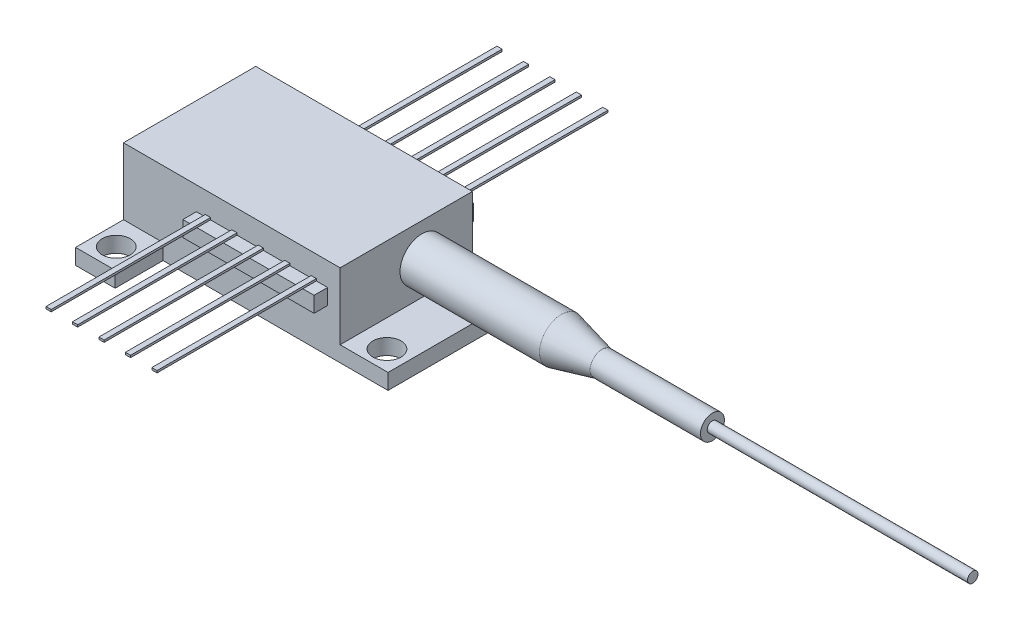
from build123d import *

# Parameters (mm, degrees)
SKETCH1_W               = 20.8
SKETCH1_H               = 12.7
BOSS_EXTRUDE1_DEPTH     = 6.4
BOSS_EXTRUDE2_DEPTH     = 1.5
SKETCH5_R               = 1.35
CUT_EXTRUDE1_DEPTH      = 21.181984541
SKETCH9_W               = 12.6
SKETCH9_H               = 1.3
BOSS_EXTRUDE4_DEPTH     = 1.5
SKETCH10_W              = 0.5
SKETCH10_H              = 15.3
BOSS_EXTRUDE5_DEPTH     = 0.2
LPATTERN1_COUNT         = 5
LPATTERN1_PITCH         = 2.54
MIRROR2_COPY_1_SKETCH_W = 0.5
MIRROR2_COPY_1_SKETCH_H = 15.3
MIRROR2_COPY_1_DEPTH    = 0.2
MIRROR2_COPY_2_SKETCH_W = 0.5
MIRROR2_COPY_2_SKETCH_H = 15.3
MIRROR2_COPY_2_DEPTH    = 0.2
MIRROR2_COPY_3_SKETCH_W = 0.5
MIRROR2_COPY_3_SKETCH_H = 15.3
MIRROR2_COPY_3_DEPTH    = 0.2
MIRROR2_COPY_4_SKETCH_W = 0.5
MIRROR2_COPY_4_SKETCH_H = 15.3
MIRROR2_COPY_4_DEPTH    = 0.2
SKETCH12_R              = 0.5
BOSS_EXTRUDE6_DEPTH     = 25


with BuildPart() as part:
    # Sketch1 → Boss-Extrude1 (new body)
    with BuildSketch(Plane(origin=(0, 0, 0), x_dir=(1, 0, 0), z_dir=(0, 1, 0))):
        Rectangle(SKETCH1_W, SKETCH1_H)
    extrude(amount=BOSS_EXTRUDE1_DEPTH)

    # Sketch3 → Boss-Extrude2 (add)
    with BuildSketch(Plane.XZ):
        Polygon((-10.4, 10.95), (-6.6, 10.95), (-6.6, 6.35), (15, 6.35), (15, -6.35), (-6.6, -6.35), (-6.6, -10.95), (-10.4, -10.95), align=None)
    extrude(amount=BOSS_EXTRUDE2_DEPTH)

    # Sketch5 → Cut-Extrude1 (cut, through all)
    with BuildSketch(Plane.XZ.offset(1.5)):
        with Locations((-8.5, 8.95)):
            Circle(SKETCH5_R)
        with Locations((13, 4.45)):
            Circle(SKETCH5_R)
    cut_extrude1 = extrude(amount=-CUT_EXTRUDE1_DEPTH, mode=Mode.SUBTRACT)

    # Mirror3: Cut-Extrude1 across plane
    add(cut_extrude1.mirror(Plane.XY), mode=Mode.SUBTRACT)

    # Sketch11 → Revolve1 (revolve)
    with BuildSketch(Plane(origin=(0, 3.2, 0), x_dir=(-1, 0, 0), z_dir=(0, -1, 0))):
        Polygon((-10.4, 1.5), (-10.4, 3.6), (-23.8, 3.6), (-27.7, 2.65), (-38.3, 2.65), (-38.3, 1.5), align=None)
    revolve(axis=Axis((10.4, 3.2, -1.5), (1, 0, 0)))

    # Sketch9 → Boss-Extrude4 (add)
    with BuildSketch(Plane(origin=(0, 2.665, 0), x_dir=(-1, 0, 0), z_dir=(0, -1, 0))):
        with Locations((-2.9, -7)):
            Rectangle(SKETCH9_W, SKETCH9_H)
    boss_extrude4 = extrude(amount=-BOSS_EXTRUDE4_DEPTH)

    # Sketch10 → Boss-Extrude5 (add)
    with BuildSketch(Plane(origin=(0, 4.165, 0), x_dir=(1, 0, 0), z_dir=(0, 1, 0))):
        with Locations((7.87, -14)):
            Rectangle(SKETCH10_W, SKETCH10_H)
    boss_extrude5 = extrude(amount=BOSS_EXTRUDE5_DEPTH)

    # LPattern1: Boss-Extrude5 ×5
    with Locations(*[(-i * LPATTERN1_PITCH, 0, 0) for i in range(1, LPATTERN1_COUNT)]):
        add(boss_extrude5)

    # Mirror2: Boss-Extrude4, Boss-Extrude5 across plane
    add(boss_extrude4.mirror(Plane.XY))
    add(boss_extrude5.mirror(Plane.XY))

    # Mirror2 copy 1 sketch → Mirror2 copy 1 (add)
    with BuildSketch(Plane(origin=(-2.54, 4.165, 0), x_dir=(1, 0, 0), z_dir=(0, 1, 0))):
        with Locations((7.87, 14)):
            Rectangle(MIRROR2_COPY_1_SKETCH_W, MIRROR2_COPY_1_SKETCH_H)
    extrude(amount=MIRROR2_COPY_1_DEPTH)

    # Mirror2 copy 2 sketch → Mirror2 copy 2 (add)
    with BuildSketch(Plane(origin=(-5.08, 4.165, 0), x_dir=(1, 0, 0), z_dir=(0, 1, 0))):
        with Locations((7.87, 14)):
            Rectangle(MIRROR2_COPY_2_SKETCH_W, MIRROR2_COPY_2_SKETCH_H)
    extrude(amount=MIRROR2_COPY_2_DEPTH)

    # Mirror2 copy 3 sketch → Mirror2 copy 3 (add)
    with BuildSketch(Plane(origin=(-7.62, 4.165, 0), x_dir=(1, 0, 0), z_dir=(0, 1, 0))):
        with Locations((7.87, 14)):
            Rectangle(MIRROR2_COPY_3_SKETCH_W, MIRROR2_COPY_3_SKETCH_H)
    extrude(amount=MIRROR2_COPY_3_DEPTH)

    # Mirror2 copy 4 sketch → Mirror2 copy 4 (add)
    with BuildSketch(Plane(origin=(-10.16, 4.165, 0), x_dir=(1, 0, 0), z_dir=(0, 1, 0))):
        with Locations((7.87, 14)):
            Rectangle(MIRROR2_COPY_4_SKETCH_W, MIRROR2_COPY_4_SKETCH_H)
    extrude(amount=MIRROR2_COPY_4_DEPTH)

    # Sketch12 → Boss-Extrude6 (add)
    with BuildSketch(Plane(origin=(38.3, 0, 0), x_dir=(0, 0, -1), z_dir=(1, 0, 0))):
        with Locations((1.5, 3.2)):
            Circle(SKETCH12_R)
    extrude(amount=BOSS_EXTRUDE6_DEPTH)


solid = part.part
